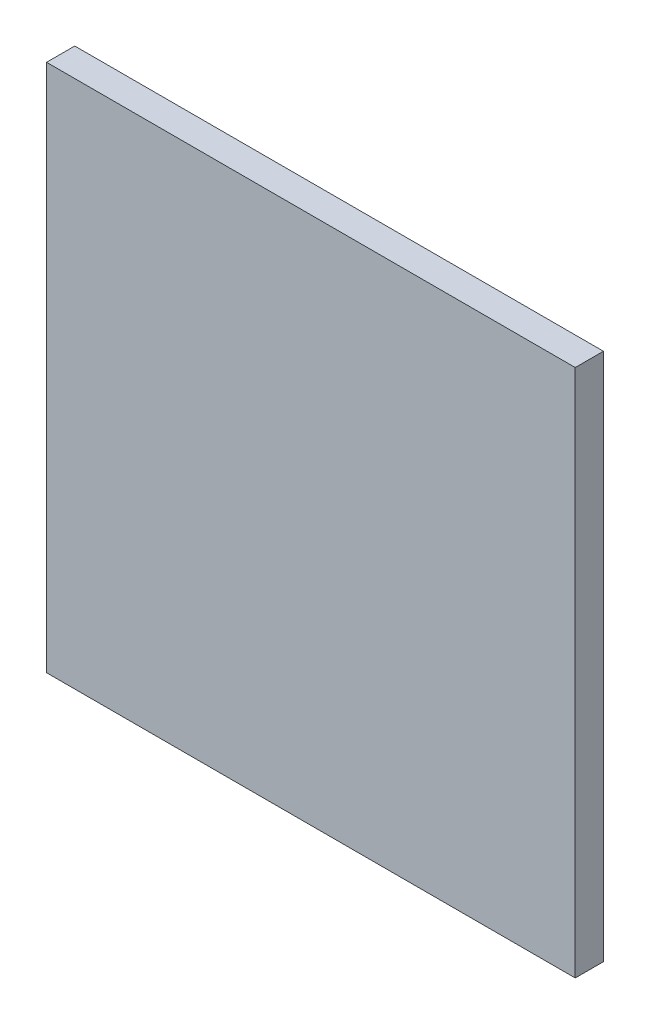
from build123d import *

# Parameters (mm, degrees)
SKETCH1_W           = 76.2
SKETCH1_H           = 76.2
BOSS_EXTRUDE1_DEPTH = 4.064


with BuildPart() as part:
    # Sketch1 → Boss-Extrude1 (new body)
    with BuildSketch(Plane.XY):
        with Locations((82.492872613, -2.605128205)):
            Rectangle(SKETCH1_W, SKETCH1_H)
    extrude(amount=BOSS_EXTRUDE1_DEPTH)


solid = part.part
